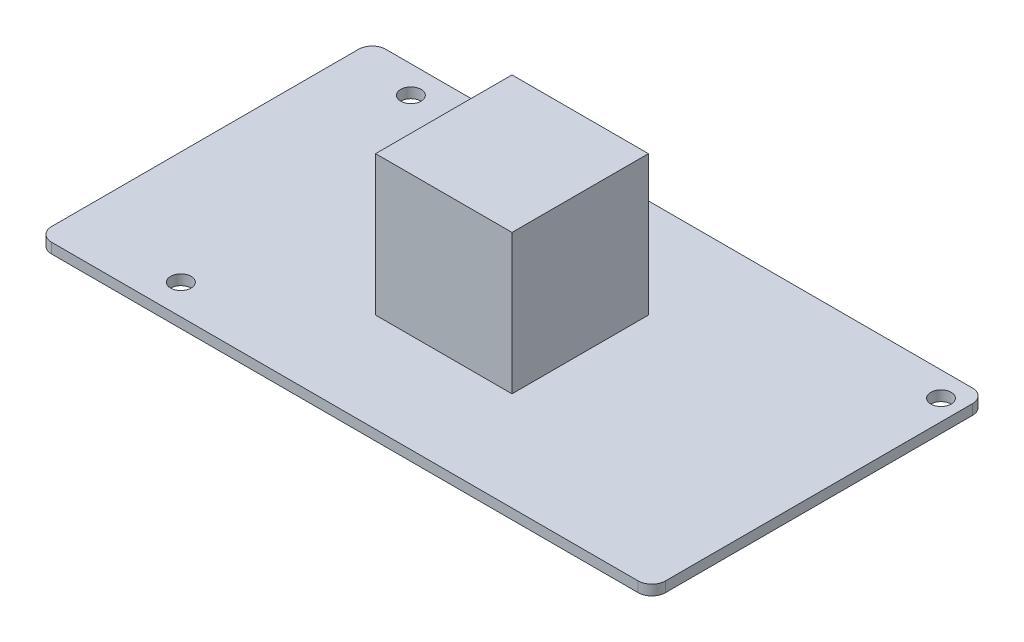
from build123d import *

# Parameters (mm, degrees)
SKETCH1_W             = 90
SKETCH1_H             = 49
BOSS_EXTRUDE1_DEPTH   = 1.5
FILLET1_R             = 2
F_1_0MM_DOWEL_HOLE1_D = 3
SKETCH4_W             = 20
SKETCH4_H             = 20
BOSS_EXTRUDE2_DEPTH   = 22


with BuildPart() as part:
    # Sketch1 → Boss-Extrude1 (new body)
    with BuildSketch(Plane(origin=(0, 0, 0), x_dir=(1, 0, 0), z_dir=(0, 1, 0))):
        Rectangle(SKETCH1_W, SKETCH1_H)
    extrude(amount=BOSS_EXTRUDE1_DEPTH)

    # Fillet1
    fillet1_edges = [part.edges().sort_by_distance(p)[0] for p in [
        (45, 0.75, 24.5),
        (-45, 0.75, 24.5),
        (-45, 0.75, -24.5),
        (45, 0.75, -24.5),
    ]]
    fillet(fillet1_edges, radius=FILLET1_R)

    # Ø1.0mm Dowel Hole1 (through all)
    with Locations(Plane(origin=(0, 1.5, 0), x_dir=(1, 0, 0), z_dir=(0, 1, 0))):
        with Locations((-35.325, 20.5), (42, 20.9), (-28.45, -20.1)):
            Hole(F_1_0MM_DOWEL_HOLE1_D / 2)

    # Sketch4 → Boss-Extrude2 (add)
    with BuildSketch(Plane.XZ):
        Rectangle(SKETCH4_W, SKETCH4_H)
    extrude(amount=-BOSS_EXTRUDE2_DEPTH)


solid = part.part
